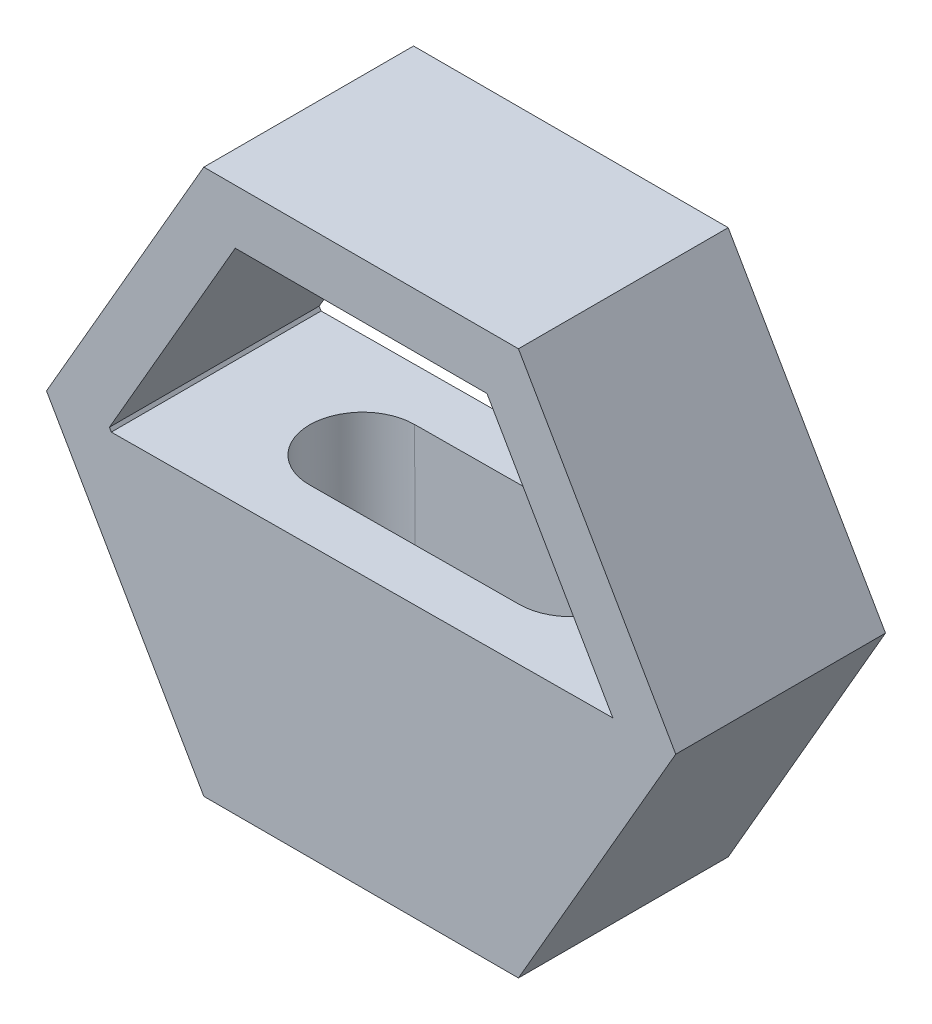
from build123d import *

# Parameters (mm, degrees)
BOSS_EXTRUDE1_DEPTH = 100
CUT_EXTRUDE1_DEPTH  = 100
CUT_EXTRUDE2_DEPTH  = 100


with BuildPart() as part:
    # Sketch1 → Boss-Extrude1 (new body)
    with BuildSketch(Plane.XY):
        Polygon((150, 0), (75, 129.903810568), (-75, 129.903810568), (-150, 0), (-75, -129.903810568), (75, -129.903810568), align=None)
    extrude(amount=-BOSS_EXTRUDE1_DEPTH)

    # Sketch2 → Cut-Extrude1 (cut)
    with BuildSketch(Plane.XY):
        Polygon((-120, 0), (-119.097636783, -1.562938939), (120, 0), (60, 103.923048454), (-60, 103.923048454), align=None)
    extrude(amount=-CUT_EXTRUDE1_DEPTH, mode=Mode.SUBTRACT)

    # Sketch3 → Cut-Extrude2 (cut)
    with BuildSketch(Plane(origin=(0.005127388, -0.784385247, 0), x_dir=(0.9999786356570095, 0.006536683375074496, 0), z_dir=(-0.006536683375074496, 0.9999786356570095, 0))):
        with BuildLine():
            Line((0.446063751, 75), (-49.553936249, 75))
            ThreePointArc((-49.553936249, 75), (-74.553936249, 50), (-49.553936249, 25))
            Line((-49.553936249, 25), (0.446063751, 25))
            ThreePointArc((0.446063751, 25), (-24.553936249, 50), (0.446063751, 75))
        make_face()
        with BuildLine():
            Line((0.446063751, 25), (0.446063751, 75))
            ThreePointArc((0.446063751, 75), (-24.553936249, 50), (0.446063751, 25))
        make_face()
        with BuildLine():
            ThreePointArc((0.446063751, 25), (25.446063751, 50), (0.446063751, 75))
            Line((0.446063751, 75), (0.446063751, 25))
        make_face()
        with BuildLine():
            ThreePointArc((0.446063751, 25), (25.446063751, 50), (0.446063751, 75))
            Line((0.446063751, 75), (50.446063751, 75))
            ThreePointArc((50.446063751, 75), (75.446063751, 50), (50.446063751, 25))
            Line((50.446063751, 25), (0.446063751, 25))
        make_face()
    extrude(amount=-CUT_EXTRUDE2_DEPTH, mode=Mode.SUBTRACT)


solid = part.part
